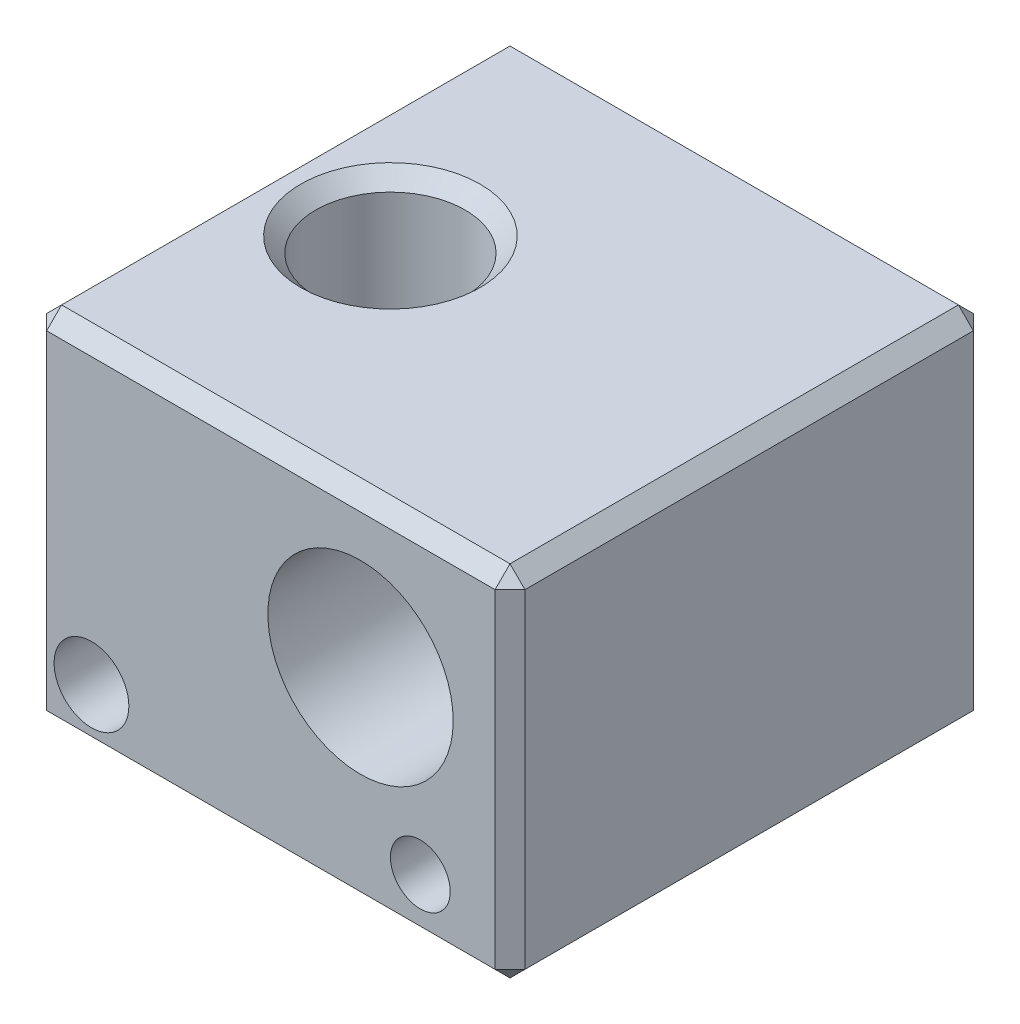
from build123d import *

# Parameters (mm, degrees)
SKETCH1_W                       = 16
SKETCH1_H                       = 16
BOSS_EXTRUDE1_DEPTH             = 12
SKETCH2_R                       = 3.1
SKETCH2_R_2                     = 1
CUT_EXTRUDE1_DEPTH              = 22.540659229
F_2_5_2_5_DIAMETER_HOLE1_D      = 2.5
F_2_5_2_5_DIAMETER_HOLE1_DEPTH  = 4.5
TAP_DRILL_FOR_M6X1_0_TAP1_D     = 5
TAP_DRILL_FOR_M3X0_5_TAP1_D     = 2.5
TAP_DRILL_FOR_M3X0_5_TAP1_DEPTH = 6.999
TAP_DRILL_FOR_M3X0_5_TAP1_TIP   = 0.751075774
CHAMFER1_SIZE                   = 0.5


with BuildPart() as part:
    # Sketch1 → Boss-Extrude1 (new body)
    with BuildSketch(Plane(origin=(0, 0, 0), x_dir=(1, 0, 0), z_dir=(0, 1, 0))):
        Rectangle(SKETCH1_W, SKETCH1_H)
    extrude(amount=BOSS_EXTRUDE1_DEPTH)

    # Sketch2 → Cut-Extrude1 (cut, through all)
    with BuildSketch(Plane.XY.offset(8)):
        with Locations((3, 7)):
            Circle(SKETCH2_R)
        with Locations((5, 2)):
            Circle(SKETCH2_R_2)
    extrude(amount=-CUT_EXTRUDE1_DEPTH, mode=Mode.SUBTRACT)

    # Ø2.5 (2.5) Diameter Hole1
    with Locations(Plane.XY.offset(8)):
        with Locations((-6, 2)):
            Hole(F_2_5_2_5_DIAMETER_HOLE1_D / 2, depth=F_2_5_2_5_DIAMETER_HOLE1_DEPTH)

    # Tap Drill for M6x1.0 Tap1 (through all)
    with Locations(Plane(origin=(0, 12, 0), x_dir=(1, 0, 0), z_dir=(0, 1, 0))):
        with Locations((-4, 0)):
            Hole(TAP_DRILL_FOR_M6X1_0_TAP1_D / 2)

    # Tap Drill for M3x0.5 Tap1
    with Locations(Plane(origin=(0, 0, 0), x_dir=(-1, 0, 0), z_dir=(0, -1, 0))):
        with Locations((-2, 0)):
            Hole(TAP_DRILL_FOR_M3X0_5_TAP1_D / 2, depth=TAP_DRILL_FOR_M3X0_5_TAP1_DEPTH)
            with Locations((0, 0, -(TAP_DRILL_FOR_M3X0_5_TAP1_DEPTH + TAP_DRILL_FOR_M3X0_5_TAP1_TIP / 2))):  # 118° drill point
                Cone(0, TAP_DRILL_FOR_M3X0_5_TAP1_D / 2, TAP_DRILL_FOR_M3X0_5_TAP1_TIP, mode=Mode.SUBTRACT)

    # Chamfer1
    chamfer1_edges = [part.edges().sort_by_distance(p)[0] for p in [
        (0, 12, -8),
        (-8, 12, 0),
        (-1.5, 12, 0),
        (-1.5, 0, 0),
        (0.75, 0, 0),
        (0, 12, 8),
        (-8, 0, 0),
        (0, 0, -8),
        (8, 0, 0),
        (0, 0, 8),
        (8, 12, 0),
        (-8, 6, 8),
        (-8, 6, -8),
        (8, 6, -8),
        (8, 6, 8),
    ]]
    chamfer(chamfer1_edges, length=CHAMFER1_SIZE)


solid = part.part
